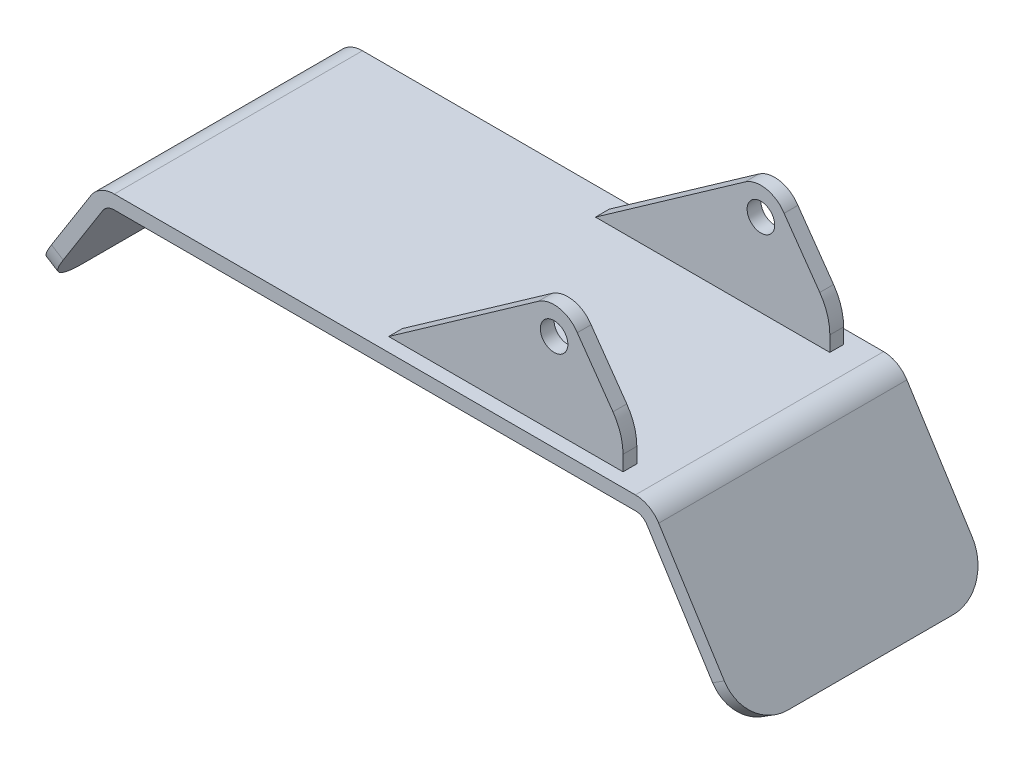
from build123d import *

# Parameters (mm, degrees)
BOSS_EXTRUDE1_DEPTH = 9
BOSS_EXTRUDE2_START = -8
SKETCH3_R           = 1
BOSS_EXTRUDE2_DEPTH = 1
FILLET3_R           = 3


with BuildPart() as part:
    # Sketch1 → Boss-Extrude1 (new, symmetric)
    with BuildSketch(Plane.XY):
        with BuildLine():
            Line((18.897662626, 0), (-18.897662626, 0))
            ThreePointArc((-18.897662626, 0), (-19.863071357, -0.248433278), (-20.588640432, -0.932014017))
            Line((-20.588640432, -0.932014017), (-25.052631579, -8))
            Line((-25.052631579, -8), (-24.207142676, -8.533992991))
            Line((-24.207142676, -8.533992991), (-19.743151529, -1.466007009))
            ThreePointArc((-19.743151529, -1.466007009), (-19.380366991, -1.124216639), (-18.897662626, -1))
            Line((-18.897662626, -1), (18.897662626, -1))
            ThreePointArc((18.897662626, -1), (19.380366991, -1.124216639), (19.743151529, -1.466007009))
            Line((19.743151529, -1.466007009), (26.101879518, -11.533992991))
            Line((26.101879518, -11.533992991), (26.947368421, -11))
            Line((26.947368421, -11), (20.588640432, -0.932014017))
            ThreePointArc((20.588640432, -0.932014017), (19.863071357, -0.248433278), (18.897662626, 0))
        make_face()
    extrude(amount=BOSS_EXTRUDE1_DEPTH, both=True)

    # Sketch3 → Boss-Extrude2 (add)
    with BuildSketch(Plane.XY.offset(BOSS_EXTRUDE2_START)):
        with BuildLine():
            Line((0, 0), (10.848900056, 7.635533222))
            ThreePointArc((10.848900056, 7.635533222), (12.385192628, 7.962556149), (13.683904275, 7.07910444))
            Line((13.683904275, 7.07910444), (16.271066443, 3.403151108))
            ThreePointArc((16.271066443, 3.403151108), (16.813414859, 2.3083729), (17, 1.10095122))
            Line((17, 1.10095122), (17, 0))
            Line((17, 0), (0, 0))
        make_face()
        with Locations((12, 6)):
            Circle(SKETCH3_R, mode=Mode.SUBTRACT)
    boss_extrude2 = extrude(amount=BOSS_EXTRUDE2_DEPTH)

    # Mirror1: Boss-Extrude2 across plane
    add(boss_extrude2.mirror(Plane.XY))

    # Fillet3
    fillet3_edges = [part.edges().sort_by_distance(p)[0] for p in [
        (26.52462397, -11.266996496, 9),
        (-24.629887127, -8.266996496, -9),
        (26.52462397, -11.266996496, -9),
        (-24.629887127, -8.266996496, 9),
    ]]
    fillet(fillet3_edges, radius=FILLET3_R)


solid = part.part
